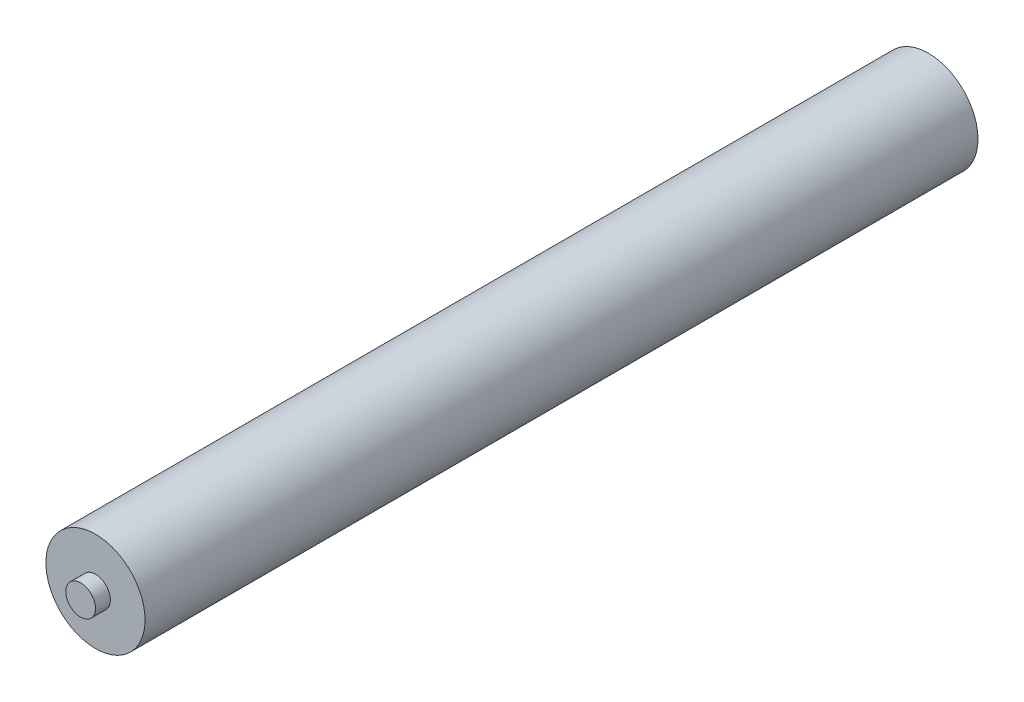
from build123d import *

# Parameters (mm, degrees)
SKETCH1_R           = 50
BOSS_EXTRUDE1_DEPTH = 420
SKETCH3_R           = 15
BOSS_EXTRUDE3_DEPTH = 435


with BuildPart() as part:
    # Sketch1 → Boss-Extrude1 (new, symmetric)
    with BuildSketch(Plane.XY):
        Circle(SKETCH1_R)
    extrude(amount=BOSS_EXTRUDE1_DEPTH, both=True)

    # Sketch3 → Boss-Extrude3 (add, symmetric)
    with BuildSketch(Plane.XY):
        with Locations(Location((0, 0, 0), (0, 0, 180))):
            Circle(SKETCH3_R)
    extrude(amount=BOSS_EXTRUDE3_DEPTH, both=True)


solid = part.part
